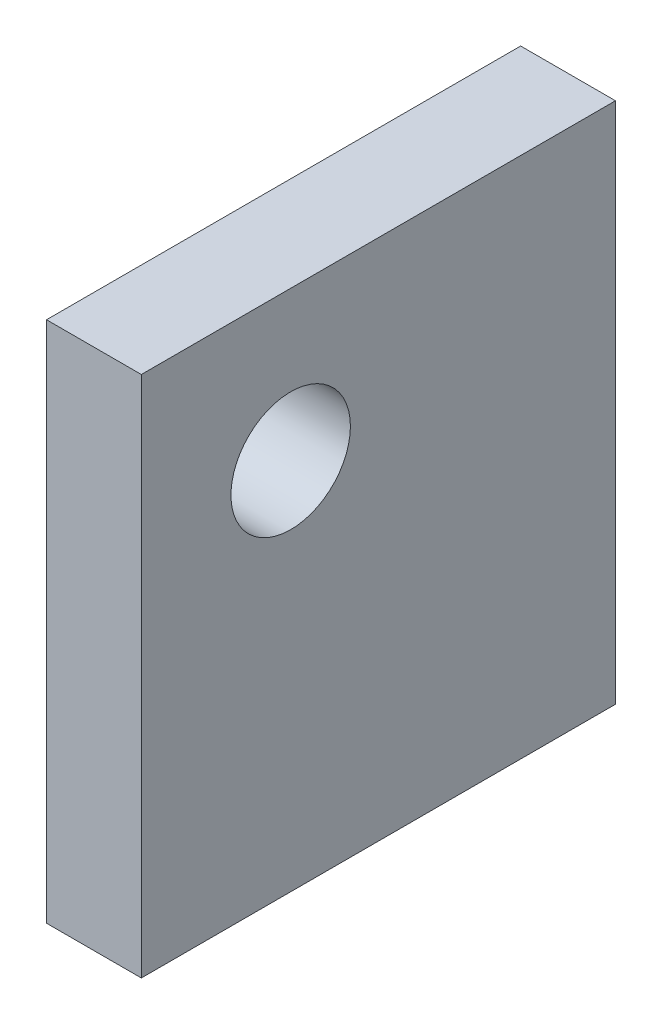
from build123d import *

# Parameters (mm, degrees)
SKETCH2_W           = 25.4
SKETCH2_H           = 127
BOSS_EXTRUDE1_DEPTH = 140
SKETCH4_R           = 16
CUT_EXTRUDE2_DEPTH  = 500


with BuildPart() as part:
    # Sketch2 → Boss-Extrude1 (new body)
    with BuildSketch(Plane(origin=(0, 0, 0), x_dir=(1, 0, 0), z_dir=(0, 1, 0))):
        with Locations((12.7, 63.5)):
            Rectangle(SKETCH2_W, SKETCH2_H)
    extrude(amount=BOSS_EXTRUDE1_DEPTH)

    # Sketch4 → Cut-Extrude2 (cut)
    with BuildSketch(Plane(origin=(25.4, 0, 0), x_dir=(0, 0, -1), z_dir=(1, 0, 0))):
        with Locations((40, 100)):
            Circle(SKETCH4_R)
    extrude(amount=-CUT_EXTRUDE2_DEPTH, mode=Mode.SUBTRACT)


solid = part.part
